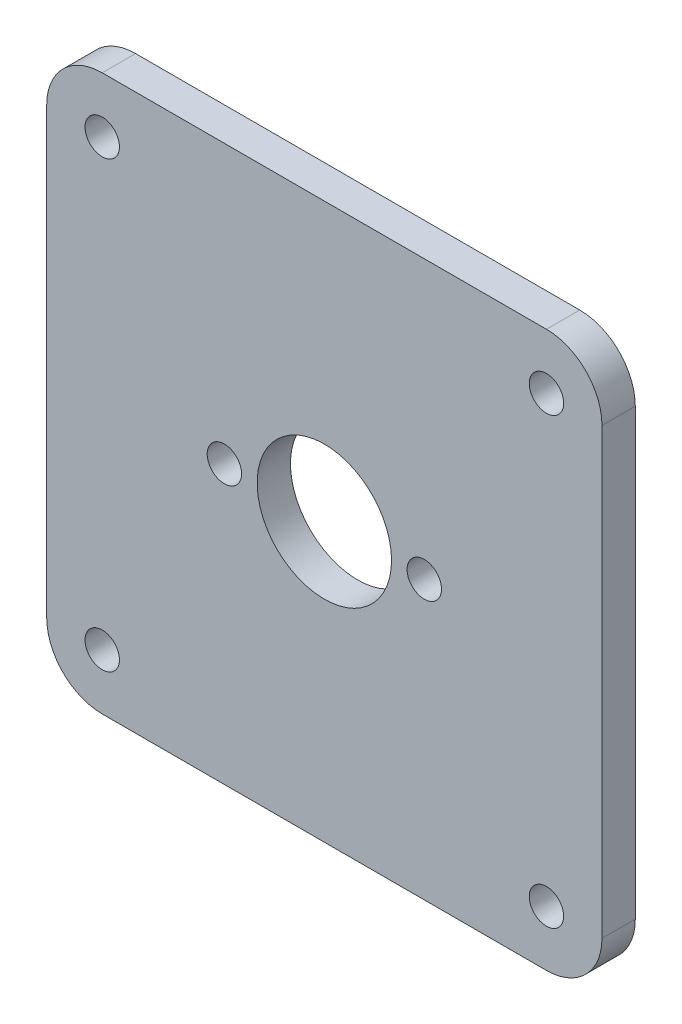
from build123d import *

# Parameters (mm, degrees)
SKETCH_1_W      = 50
SKETCH_1_H      = 50
SKETCH_1_R      = 1.55
SKETCH_1_R_2    = 6.05
EXTRUDE_1_DEPTH = 3
FILLET_1_R      = 5


with BuildPart() as part:
    # ｽｹｯﾁ1 → ﾎﾞｽ - 押し出し1 (new body)
    with BuildSketch(Plane.XY):
        Rectangle(SKETCH_1_W, SKETCH_1_H)
        with Locations((-20, 20)):
            Circle(SKETCH_1_R, mode=Mode.SUBTRACT)
        with Locations((20, 20)):
            Circle(SKETCH_1_R, mode=Mode.SUBTRACT)
        with Locations((20, -20)):
            Circle(SKETCH_1_R, mode=Mode.SUBTRACT)
        with Locations((-20, -20)):
            Circle(SKETCH_1_R, mode=Mode.SUBTRACT)
        Circle(SKETCH_1_R_2, mode=Mode.SUBTRACT)
        with Locations((-9, 0)):
            Circle(SKETCH_1_R, mode=Mode.SUBTRACT)
        with Locations(Location((9, 0, 0), (0, 0, 180))):
            Circle(SKETCH_1_R, mode=Mode.SUBTRACT)
    extrude(amount=EXTRUDE_1_DEPTH)

    # ﾌｨﾚｯﾄ1
    fillet_1_edges = [part.edges().sort_by_distance(p)[0] for p in [
        (25, -25, 1.5),
        (-25, -25, 1.5),
        (-25, 25, 1.5),
        (25, 25, 1.5),
    ]]
    fillet(fillet_1_edges, radius=FILLET_1_R)


solid = part.part
